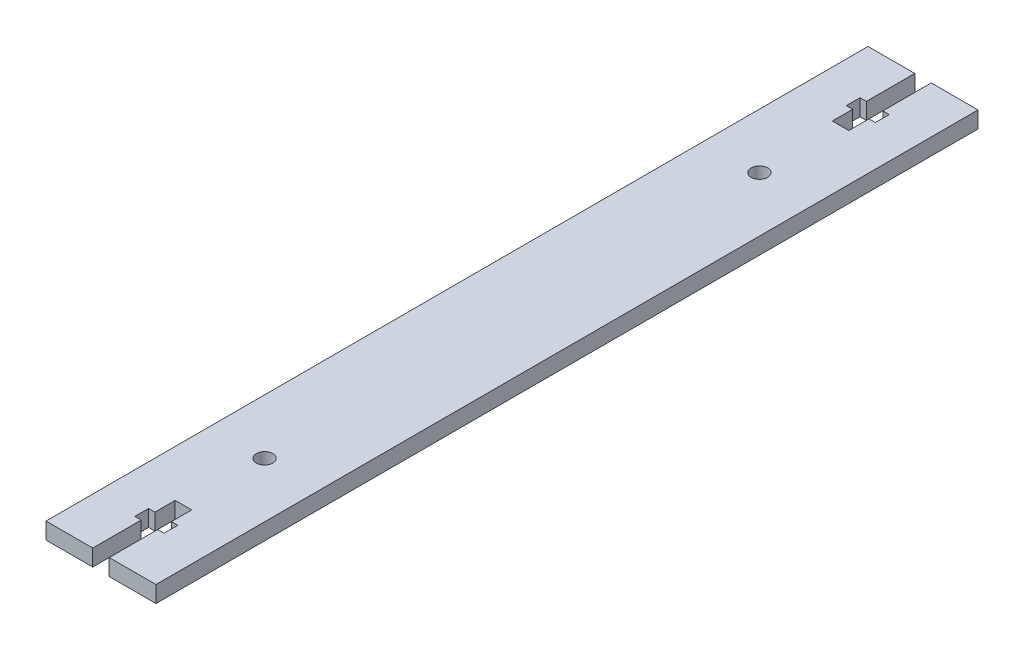
from build123d import *

# Parameters (mm, degrees)
SKETCH2_W           = 40
SKETCH2_H           = 6
BOSS_EXTRUDE2_DEPTH = 299
SKETCH4_R           = 3
CUT_EXTRUDE2_DEPTH  = 42
CUT_EXTRUDE4_DEPTH  = 42


with BuildPart() as part:
    # Sketch2 → Boss-Extrude2 (new body)
    with BuildSketch(Plane.XY):
        Rectangle(SKETCH2_W, SKETCH2_H)
    extrude(amount=BOSS_EXTRUDE2_DEPTH)

    # Sketch4 → Cut-Extrude2 (cut, symmetric)
    with BuildSketch(Plane(origin=(0, 3, 0), x_dir=(1, 0, 0), z_dir=(0, 1, 0))):
        with Locations(Location((0, -59.5, 0), (0, 0, 270))):
            Circle(SKETCH4_R)
        with Locations(Location((0, -239.5, 0), (0, 0, 270))):
            Circle(SKETCH4_R)
    extrude(amount=CUT_EXTRUDE2_DEPTH, both=True, mode=Mode.SUBTRACT)

    # Sketch5 → Cut-Extrude4 (cut, symmetric)
    with BuildSketch(Plane(origin=(0, 3, 0), x_dir=(1, 0, 0), z_dir=(0, 1, 0))):
        Polygon((-3, -299), (3, -299), (3, -281.386427855), (5.311461506, -281.386427855), (5.311461506, -276.386427855), (3, -276.386427855), (3, -269), (-3, -269), (-3, -276.386427855), (-5.311461506, -276.386427855), (-5.311461506, -281.386427855), (-3, -281.386427855), align=None)
    cut_extrude4 = extrude(amount=CUT_EXTRUDE4_DEPTH, both=True, mode=Mode.SUBTRACT)

    # Mirror2: Cut-Extrude4 across plane
    add(cut_extrude4.mirror(Plane.XY.offset(149.5)), mode=Mode.SUBTRACT)


solid = part.part
